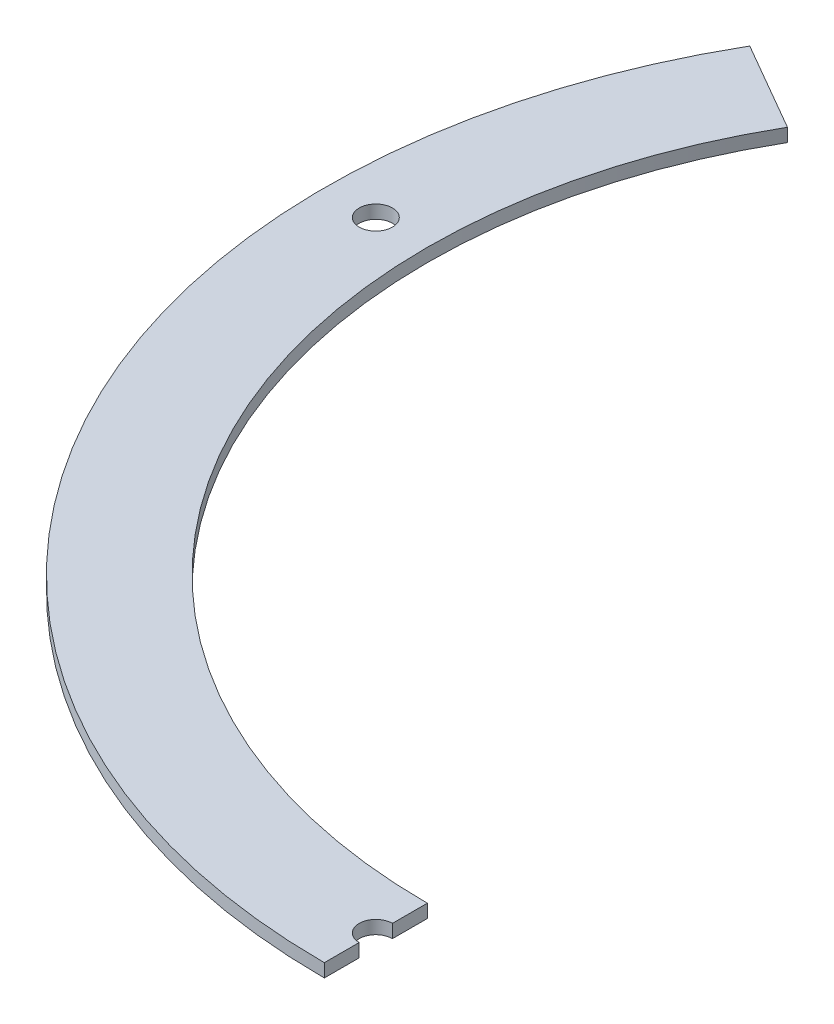
from build123d import *

# Parameters (mm, degrees)
SKETCH_1_R          = 101
SKETCH_1_R_2        = 85.5
SKETCH_1_R_3        = 2.5
EXTRUDE_2_DEPTH     = 2
SKETCH_4_R          = 2.5
CUT_EXTRUDE_2_DEPTH = 2
SKETCH_5_R          = 2.5
CUT_EXTRUDE_3_DEPTH = 2


with BuildPart() as part:
    # 草图1 → 凸台-拉伸2 (new body)
    with BuildSketch(Plane(origin=(0, 0, 0), x_dir=(1, 0, 0), z_dir=(0, 1, 0))):
        with Locations(Location((0, 0, 0), (0, 0, 270))):
            Circle(SKETCH_1_R)
        with Locations(Location((0, 0, 0), (0, 0, 270))):
            Circle(SKETCH_1_R_2, mode=Mode.SUBTRACT)
        with Locations(Location((0, 93.25, 0), (0, 0, 270))):
            Circle(SKETCH_1_R_3, mode=Mode.SUBTRACT)
        with Locations(Location((93.25, 0, 0), (0, 0, 270))):
            Circle(SKETCH_1_R_3, mode=Mode.SUBTRACT)
        with Locations(Location((0, -93.25, 0), (0, 0, 270))):
            Circle(SKETCH_1_R_3, mode=Mode.SUBTRACT)
        with Locations(Location((-93.25, 0, 0), (0, 0, 270))):
            Circle(SKETCH_1_R_3, mode=Mode.SUBTRACT)
    extrude(amount=EXTRUDE_2_DEPTH)

    # 草图4 → 切除-拉伸2 (cut)
    with BuildSketch(Plane.XZ):
        with BuildLine():
            Line((87.468565782, -50.5), (74.045172024, -42.75))
            ThreePointArc((74.045172024, -42.75), (0, -85.5), (-74.045172024, -42.75))
            Line((-74.045172024, -42.75), (-87.468565782, -50.5))
            ThreePointArc((-87.468565782, -50.5), (0, -101), (87.468565782, -50.5))
        make_face()
        with Locations((0, -93.25)):
            Circle(SKETCH_4_R, mode=Mode.SUBTRACT)
    extrude(amount=-CUT_EXTRUDE_2_DEPTH, mode=Mode.SUBTRACT)

    # 草图5 → 切除-拉伸3 (cut)
    with BuildSketch(Plane.XZ):
        with BuildLine():
            Line((0, 90.75), (0, 85.5))
            ThreePointArc((0, 85.5), (74.045172024, 42.75), (74.045172024, -42.75))
            Line((74.045172024, -42.75), (87.468565782, -50.5))
            ThreePointArc((87.468565782, -50.5), (97.558508455, -26.140723555), (101, 0))
            ThreePointArc((101, 0), (71.4177849, 71.4177849), (0, 101))
            Line((0, 101), (0, 95.75))
            ThreePointArc((0, 95.75), (1.767766953, 95.017766953), (2.5, 93.25))
            ThreePointArc((2.5, 93.25), (1.767766953, 91.482233047), (0, 90.75))
        make_face()
        with Locations((93.25, 0)):
            Circle(SKETCH_5_R, mode=Mode.SUBTRACT)
    extrude(amount=-CUT_EXTRUDE_3_DEPTH, mode=Mode.SUBTRACT)


solid = part.part
